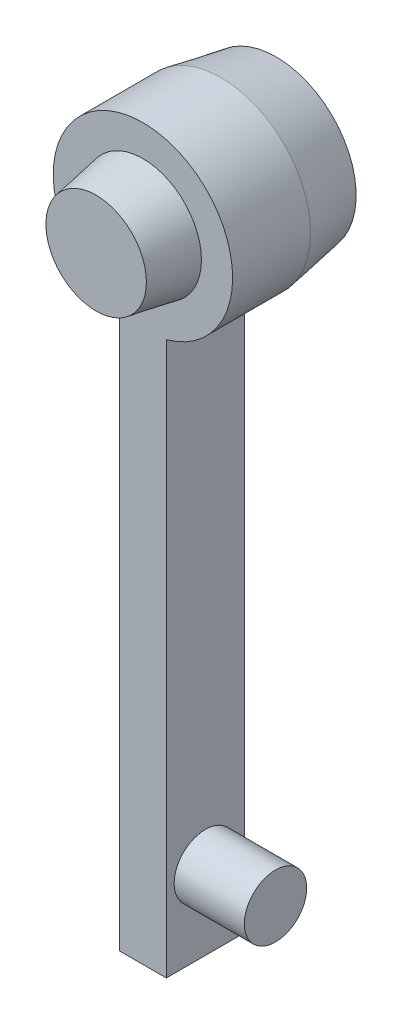
from build123d import *

# Parameters (mm, degrees)
BOSS_EXTRUDE1_DEPTH = 5
SKETCH2_R           = 7.5
BOSS_EXTRUDE2_DEPTH = 6
BOSS_EXTRUDE2_TAPER = 10
SKETCH3_R           = 4
BOSS_EXTRUDE3_DEPTH = 9
SKETCH4_R           = 11.5
SKETCH4_R_2         = 9
BOSS_EXTRUDE4_DEPTH = 9
BOSS_EXTRUDE4_TAPER = 10


with BuildPart() as part:
    # Sketch1 → Boss-Extrude1 (new, symmetric)
    with BuildSketch(Plane.XY):
        with BuildLine():
            Line((3, 29.898198344), (3, -41))
            Line((3, -41), (-3, -41))
            Line((-3, -41), (-3, 29.898198344))
            ThreePointArc((-3, 29.898198344), (0, 52.5), (3, 29.898198344))
        make_face()
    extrude(amount=BOSS_EXTRUDE1_DEPTH, both=True)

    # Sketch2 → Boss-Extrude2 (add)
    with BuildSketch(Plane.XY.offset(5)):
        with Locations((0, 41)):
            Circle(SKETCH2_R)
    extrude(amount=BOSS_EXTRUDE2_DEPTH, taper=BOSS_EXTRUDE2_TAPER)

    # Sketch3 → Boss-Extrude3 (add)
    with BuildSketch(Plane(origin=(3, 0, 0), x_dir=(0, 0, -1), z_dir=(1, 0, 0))):
        with Locations(Location((0, -31, 0), (0, 0, 90))):
            Circle(SKETCH3_R)
    extrude(amount=BOSS_EXTRUDE3_DEPTH)

    # Sketch4 → Boss-Extrude4 (add)
    with BuildSketch(Plane(origin=(0, 0, -5), x_dir=(-1, 0, 0), z_dir=(0, 0, -1))):
        with Locations((0, 41)):
            Circle(SKETCH4_R)
        with Locations((0, 41)):
            Circle(SKETCH4_R_2, mode=Mode.SUBTRACT)
    extrude(amount=BOSS_EXTRUDE4_DEPTH, taper=BOSS_EXTRUDE4_TAPER)


solid = part.part
